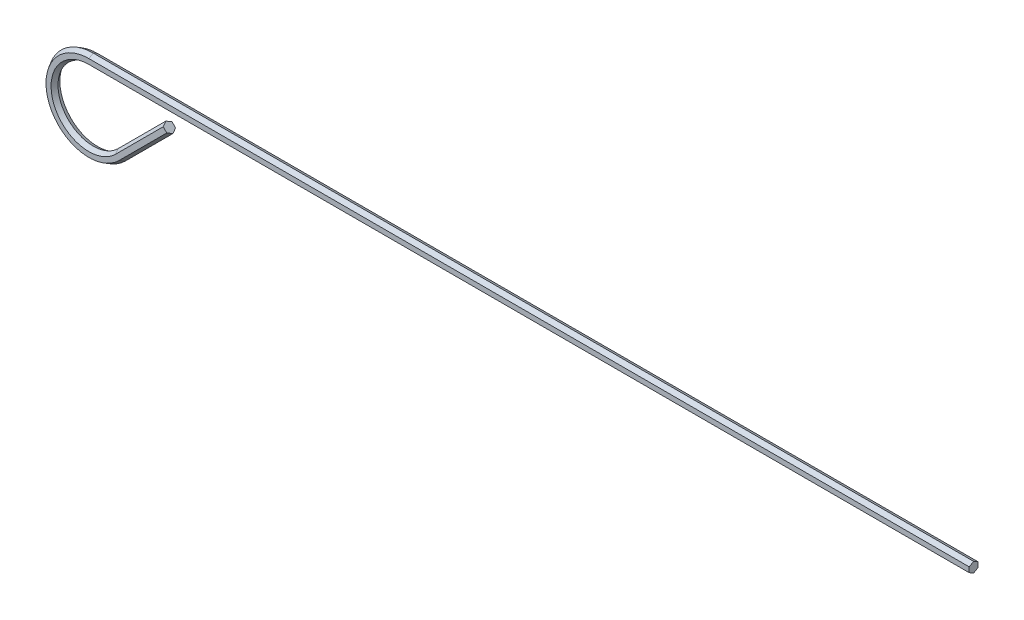
from build123d import *


with BuildPart() as part:
    # Base-Sweep: sweep along a path in Sketch1
    with BuildLine(Plane.XY) as base_sweep_path:
        Line((100, 4), (0, 4))
        ThreePointArc((0, 4), (-3.69551813, -1.530733729), (2.828427125, -2.828427125))
        Line((2.828427125, -2.828427125), (8.242640687, 2.585786438))
    # Sketch2 → Base-Sweep (sweep)
    with BuildSketch(Plane(origin=(100, 4, 0), x_dir=(0, 0, 1), z_dir=(-1, 0, 0))):
        Polygon((-0.5, 0.866025404), (0, 1.154700538), (0.5, 0.866025404), (0.5, 0.288675135), (0, 0), (-0.5, 0.288675135), align=None)
    sweep(path=base_sweep_path.line)


solid = part.part
